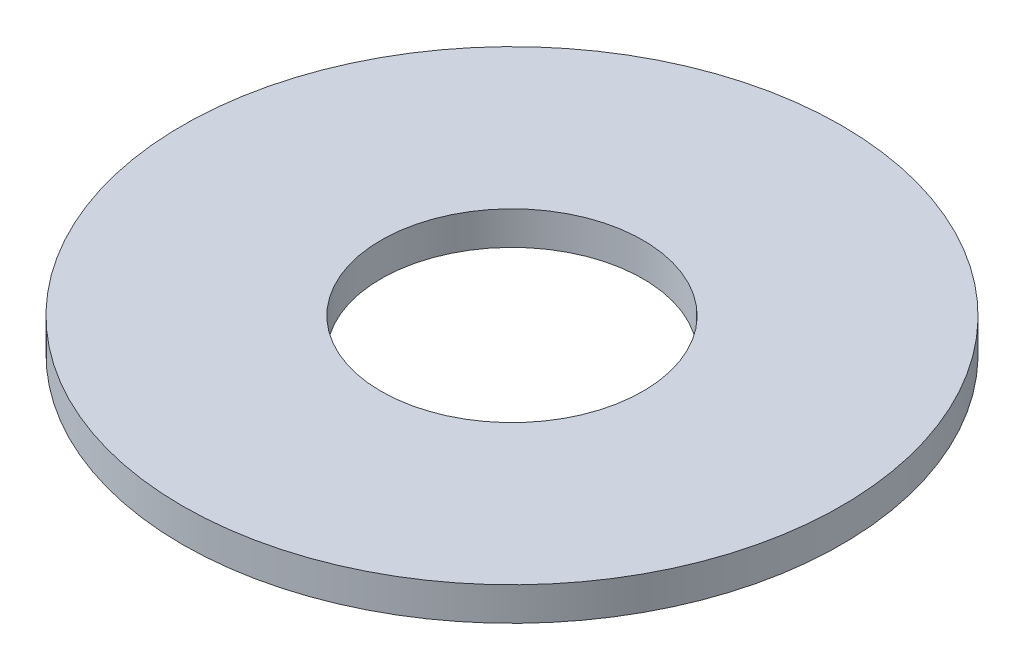
from build123d import *

# Parameters (mm, degrees)
SKETCH1_R           = 4.7625
BOSS_EXTRUDE1_DEPTH = 0.4826
SKETCH5_R           = 1.8923
CUT_EXTRUDE1_DEPTH  = 7.752459941


with BuildPart() as part:
    # Sketch1 → Boss-Extrude1 (new body)
    with BuildSketch(Plane(origin=(0, 0, 0), x_dir=(1, 0, 0), z_dir=(0, 1, 0))):
        with Locations(Location((0, 0, 0), (0, 0, 90))):
            Circle(SKETCH1_R)
    extrude(amount=BOSS_EXTRUDE1_DEPTH)

    # Sketch5 → Cut-Extrude1 (cut, through all)
    with BuildSketch(Plane(origin=(0, 0.4826, 0), x_dir=(-1, 0, 0), z_dir=(0, 1, 0))):
        with Locations(Location((0, 0, 0), (0, 0, 90))):
            Circle(SKETCH5_R)
    extrude(amount=-CUT_EXTRUDE1_DEPTH, mode=Mode.SUBTRACT)


solid = part.part
